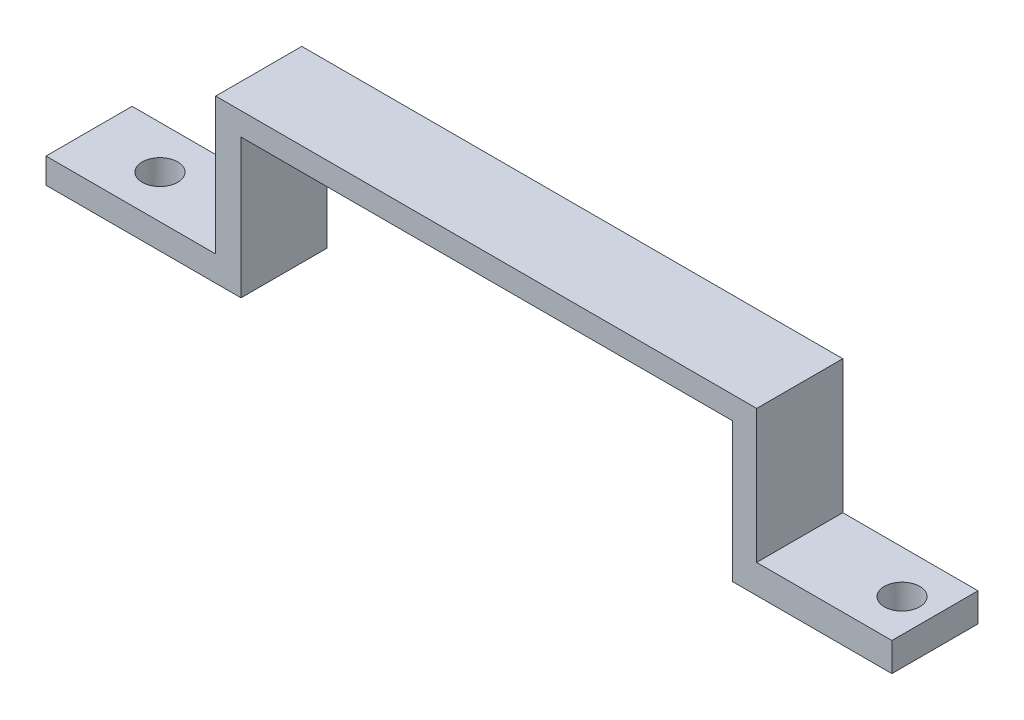
from build123d import *

# Parameters (mm, degrees)
SKETCH1_W           = 84.836
SKETCH1_H           = 8.636
BOSS_EXTRUDE1_DEPTH = 16.256
SKETCH2_W           = 49.276
SKETCH2_H           = 13.97
CUT_EXTRUDE1_DEPTH  = 134.757308654
SKETCH3_R           = 1.778
CUT_EXTRUDE2_DEPTH  = 147.33606739
SKETCH4_W           = 17.018
SKETCH4_H           = 13.716
SKETCH4_W_2         = 13.561760772
SKETCH4_H_2         = 13.376292463
CUT_EXTRUDE3_DEPTH  = 134.757308654


with BuildPart() as part:
    # Sketch1 → Boss-Extrude1 (new body)
    with BuildSketch(Plane(origin=(0, 0, 0), x_dir=(1, 0, 0), z_dir=(0, 1, 0))):
        with Locations((-90.066639058, 55.663726359)):
            Rectangle(SKETCH1_W, SKETCH1_H)
    extrude(amount=BOSS_EXTRUDE1_DEPTH)

    # Sketch2 → Cut-Extrude1 (cut, through all)
    with BuildSketch(Plane.XY.offset(-51.345726359)):
        with Locations((-88.288639058, 6.985)):
            Rectangle(SKETCH2_W, SKETCH2_H)
    extrude(amount=-CUT_EXTRUDE1_DEPTH, mode=Mode.SUBTRACT)

    # Sketch3 → Cut-Extrude2 (cut, through all)
    with BuildSketch(Plane(origin=(0, 16.256, 0), x_dir=(1, 0, 0), z_dir=(0, 1, 0))):
        with Locations(Location((-50.950639058, 55.663726359, 0), (0, 0, 270))):
            Circle(SKETCH3_R)
        with Locations(Location((-125.372639058, 55.663726359, 0), (0, 0, 270))):
            Circle(SKETCH3_R)
    extrude(amount=-CUT_EXTRUDE2_DEPTH, mode=Mode.SUBTRACT)

    # Sketch4 → Cut-Extrude3 (cut, through all)
    with BuildSketch(Plane.XY.offset(-51.345726359)):
        with Locations((-123.975639058, 9.398)):
            Rectangle(SKETCH4_W, SKETCH4_H)
        with Locations((-54.429519444, 9.567853769)):
            Rectangle(SKETCH4_W_2, SKETCH4_H_2)
    extrude(amount=-CUT_EXTRUDE3_DEPTH, mode=Mode.SUBTRACT)


solid = part.part
